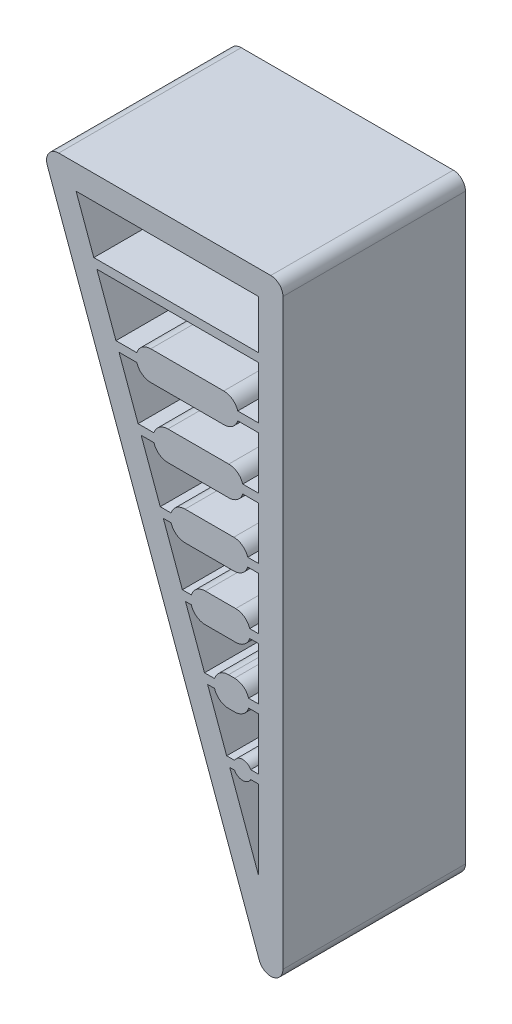
from build123d import *

# Parameters (mm, degrees)
BOSS_EXTRUDE2_DEPTH = 30
FILLET2_R           = 2
BOSS_EXTRUDE3_DEPTH = 30
SKETCH5_R           = 1.5
BOSS_EXTRUDE4_DEPTH = 30


with BuildPart() as part:
    # Sketch1 → Boss-Extrude2 (new body)
    with BuildSketch(Plane.XY):
        Polygon((4, 4), (-35.712592027, 4), (4, -105.109449862), align=None)
        Polygon((0, 0), (-30, 0), (-27.088238126, -8), (0, -8), align=None, mode=Mode.SUBTRACT)
        Polygon((0, -82.424322584), (0, -69.4), (-4.740465742, -69.4), align=None, mode=Mode.SUBTRACT)
        Polygon((-26.578679798, -9.4), (0, -9.4), (0, -18), (-23.448535783, -18), align=None, mode=Mode.SUBTRACT)
        Polygon((-22.938977455, -19.4), (0, -19.4), (0, -28), (-19.808833441, -28), align=None, mode=Mode.SUBTRACT)
        Polygon((-19.299275113, -29.4), (0, -29.4), (0, -38), (-16.169131098, -38), align=None, mode=Mode.SUBTRACT)
        Polygon((-15.65957277, -39.4), (0, -39.4), (0, -48), (-12.529428755, -48), align=None, mode=Mode.SUBTRACT)
        Polygon((-12.019870427, -49.4), (0, -49.4), (0, -58), (-8.889726413, -58), align=None, mode=Mode.SUBTRACT)
        Polygon((-8.380168085, -59.4), (0, -59.4), (0, -68), (-5.25002407, -68), align=None, mode=Mode.SUBTRACT)
    extrude(amount=BOSS_EXTRUDE2_DEPTH)

    # Fillet2
    fillet2_edges = [part.edges().sort_by_distance(p)[0] for p in [
        (-35.712592027, 4, 15),
        (4, 4, 15),
        (4, -105.109449862, 15),
    ]]
    fillet(fillet2_edges, radius=FILLET2_R)

    # Sketch4 → Boss-Extrude3 (add)
    with BuildSketch(Plane.XY.offset(30)):
        with BuildLine():
            Line((-14.90441672, -26.3), (-4.90441672, -26.3))
            ThreePointArc((-4.90441672, -26.3), (-2.50441672, -28.7), (-4.90441672, -31.1))
            Line((-4.90441672, -31.1), (-14.90441672, -31.1))
            ThreePointArc((-14.90441672, -31.1), (-17.30441672, -28.7), (-14.90441672, -26.3))
        make_face()
        with BuildLine():
            Line((-4.084565549, -41.1), (-12.084565549, -41.1))
            ThreePointArc((-12.084565549, -41.1), (-14.484565549, -38.7), (-12.084565549, -36.3))
            Line((-12.084565549, -36.3), (-4.084565549, -36.3))
            ThreePointArc((-4.084565549, -36.3), (-1.684565549, -38.7), (-4.084565549, -41.1))
        make_face()
        with BuildLine():
            Line((-8.764714378, -46.3), (-3.764714378, -46.3))
            ThreePointArc((-3.764714378, -46.3), (-1.364714378, -48.7), (-3.764714378, -51.1))
            Line((-3.764714378, -51.1), (-8.764714378, -51.1))
            ThreePointArc((-8.764714378, -51.1), (-11.164714378, -48.7), (-8.764714378, -46.3))
        make_face()
        with BuildLine():
            Line((-4.944863206, -56.3), (-3.944863206, -56.3))
            ThreePointArc((-3.944863206, -56.3), (-1.544863206, -58.7), (-3.944863206, -61.1))
            Line((-3.944863206, -61.1), (-4.944863206, -61.1))
            ThreePointArc((-4.944863206, -61.1), (-7.344863206, -58.7), (-4.944863206, -56.3))
        make_face()
        with BuildLine():
            Line((-5.724267892, -21.1), (-17.724267892, -21.1))
            ThreePointArc((-17.724267892, -21.1), (-20.124267892, -18.7), (-17.724267892, -16.3))
            Line((-17.724267892, -16.3), (-5.724267892, -16.3))
            ThreePointArc((-5.724267892, -16.3), (-3.324267892, -18.7), (-5.724267892, -21.1))
        make_face()
    extrude(amount=-BOSS_EXTRUDE3_DEPTH)

    # Sketch5 → Boss-Extrude4 (add)
    with BuildSketch(Plane.XY.offset(30)):
        with Locations((-2.625012035, -68.7)):
            Circle(SKETCH5_R)
    extrude(amount=-BOSS_EXTRUDE4_DEPTH)


solid = part.part
